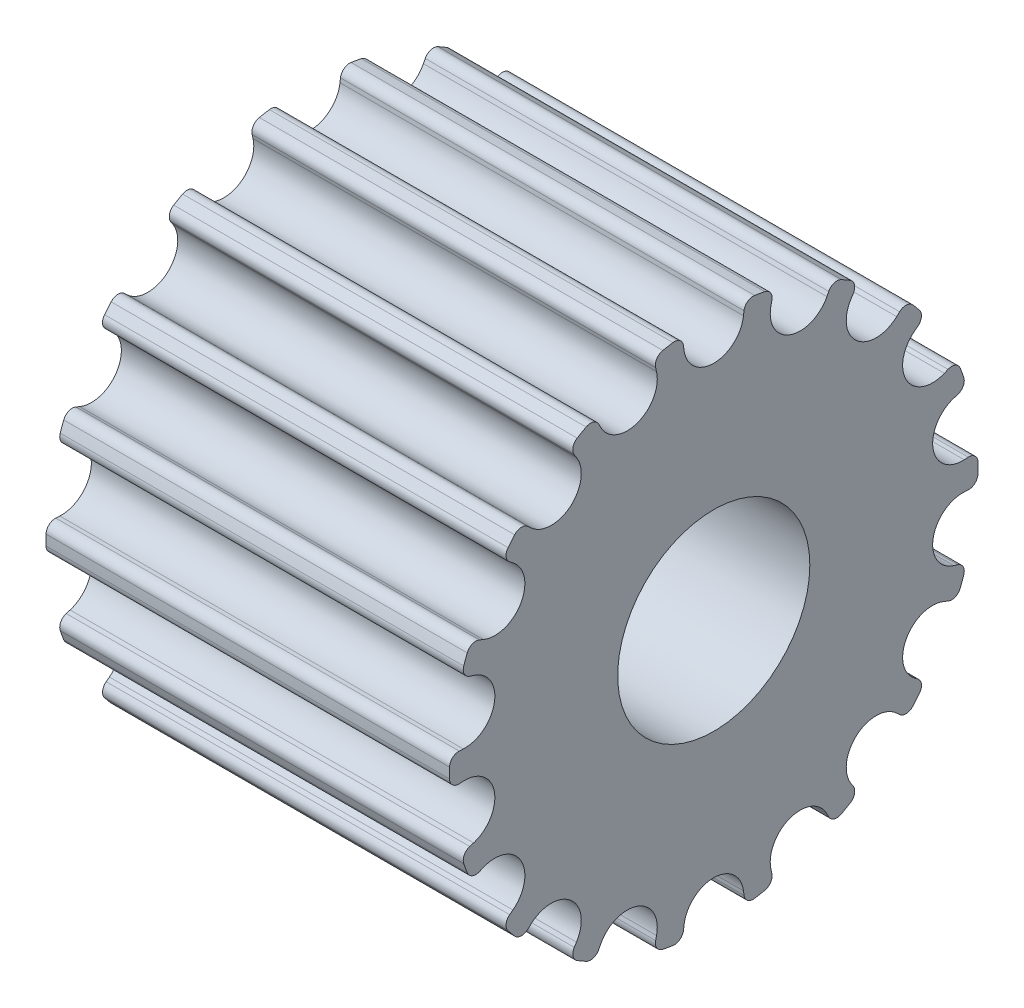
from build123d import *

# Parameters (mm, degrees)
CHAMFER_1_SIZE           = 1
SKETCH_4_W               = 2
SKETCH_4_H               = 1
CUT_EXTRUDE_1_DEPTH      = 35.092374778
CUT_EXTRUDE_2_REACH      = 36.092
PATTERN_CIRCULAR_3_COUNT = 18
SKETCH_7_R               = 16.570868864
CUT_EXTRUDE_3_DEPTH      = 7
SKETCH_8_R               = 8.79239993
EXTRUDE_1_DEPTH          = 21
SKETCH_9_R               = 5
CUT_EXTRUDE_4_DEPTH      = 21


with BuildPart() as part:
    # 草图1 → 旋转1 (revolve)
    with BuildSketch(Plane.XY, mode=Mode.PRIVATE) as revolve_1_sk:
        Polygon((0, 2.7506), (0, 13.753), (28, 13.753), (28, 5.5012), (20, 5.5012), (20, 2.7506), align=None)
    revolve(revolve_1_sk.sketch.rotate(Axis((0, 0, 0), (1, 0, 0)), 90), axis=Axis((0, 0, 0), (1, 0, 0)))

    # 倒角1
    chamfer_1_edges = [part.edges().sort_by_distance(p)[0] for p in [
        (20, 0, -2.7506),
        (0, 0, -2.7506),
    ]]
    chamfer(chamfer_1_edges, length=CHAMFER_1_SIZE)

    # 草图4 → 切除-拉伸1 (cut, through all)
    with BuildSketch(Plane.ZY):
        with Locations((0, 3.062381775)):
            Rectangle(SKETCH_4_W, SKETCH_4_H)
    extrude(amount=-CUT_EXTRUDE_1_DEPTH, mode=Mode.SUBTRACT)

    # 草图6 → 切除-拉伸2 (cut, up to next)
    with BuildSketch(Plane(origin=(0, 0, 0), x_dir=(0, 0, -1), z_dir=(1, 0, 0)), mode=Mode.PRIVATE) as cut_extrude_2_sk1:
        with BuildLine():
            Line((1.574067282, 13.17215513), (1.548371997, 12.962883824))
            ThreePointArc((1.548371997, 12.962883824), (0, 11.593), (-1.548371997, 12.962883824))
            Line((-1.548371997, 12.962883824), (-1.574067282, 13.17215513))
            ThreePointArc((-1.574067282, 13.17215513), (-1.761240253, 13.496717776), (-2.124642597, 13.587895453))
            ThreePointArc((-2.124642597, 13.587895453), (-2.36143787, 13.548749765), (-2.597513963, 13.505477785))
            Line((-2.597513963, 13.505477785), (-2.794161951, 15.107047128))
            ThreePointArc((-2.794161951, 15.107047128), (0, 15.363274844), (2.794161951, 15.107047128))
            Line((2.794161951, 15.107047128), (2.597513963, 13.505477785))
            ThreePointArc((2.597513963, 13.505477785), (2.36143787, 13.548749765), (2.124642597, 13.587895453))
            ThreePointArc((2.124642597, 13.587895453), (1.761240253, 13.496717776), (1.574067282, 13.17215513))
        make_face()
    cut_extrude_2_tool1 = extrude(cut_extrude_2_sk1.sketch, amount=CUT_EXTRUDE_2_REACH, mode=Mode.PRIVATE) & part.part
    cut_extrude_2 = cut_extrude_2_tool1.solids().sort_by_distance((0, 13.819423, 0))[0]
    add(cut_extrude_2, mode=Mode.SUBTRACT)

    # 阵列(圆周)3: 切除-拉伸2 ×18 about axis
    pattern_circular_3_axis = Axis((0, 0, 0), (1, 0, 0))
    for i in range(1, PATTERN_CIRCULAR_3_COUNT):
        add(cut_extrude_2.rotate(pattern_circular_3_axis, i * 360 / PATTERN_CIRCULAR_3_COUNT), mode=Mode.SUBTRACT)

    # 草图7 → 切除-拉伸3 (cut)
    with BuildSketch(Plane(origin=(28, 0, 0), x_dir=(0, 0, -1), z_dir=(1, 0, 0))):
        Circle(SKETCH_7_R)
    extrude(amount=-CUT_EXTRUDE_3_DEPTH, mode=Mode.SUBTRACT)

    # 草图8 → 凸台-拉伸1 (add)
    with BuildSketch(Plane(origin=(21, 0, 0), x_dir=(0, 0, -1), z_dir=(1, 0, 0))):
        Circle(SKETCH_8_R)
    extrude(amount=-EXTRUDE_1_DEPTH)

    # 草图9 → 切除-拉伸4 (cut)
    with BuildSketch(Plane(origin=(21, 0, 0), x_dir=(0, 0, -1), z_dir=(1, 0, 0))):
        Circle(SKETCH_9_R)
    extrude(amount=-CUT_EXTRUDE_4_DEPTH, mode=Mode.SUBTRACT)


solid = part.part
